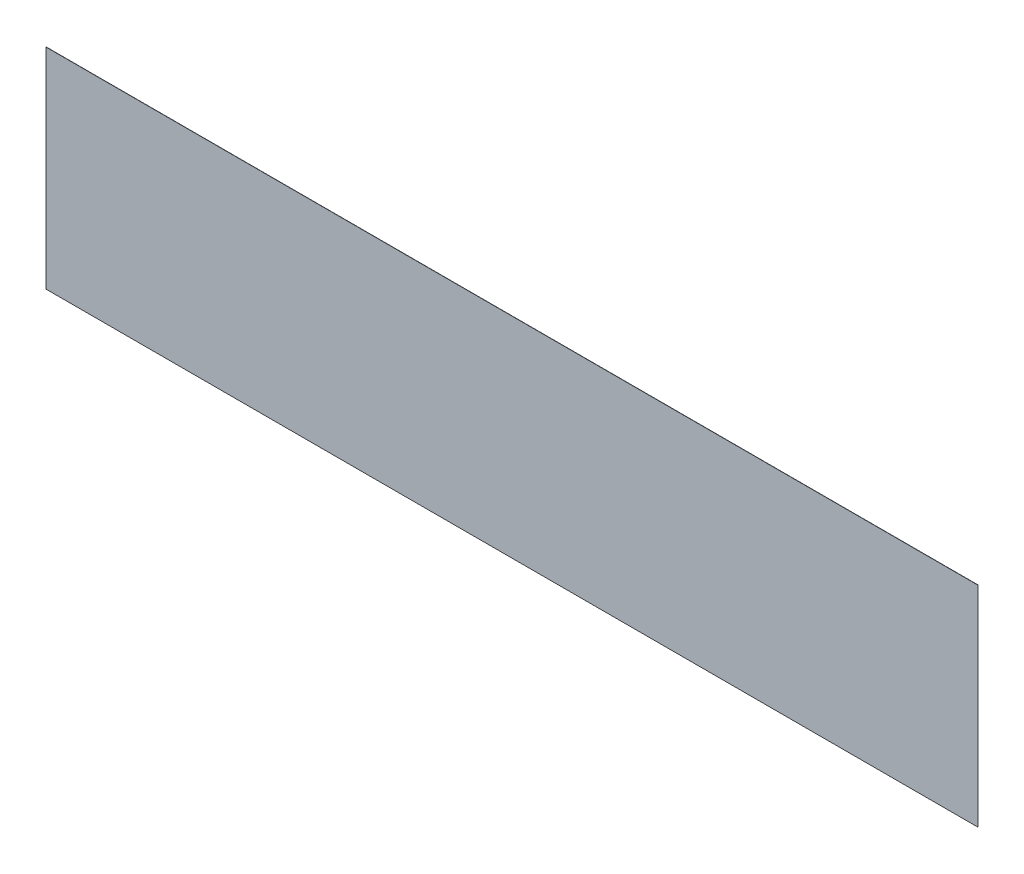
from build123d import *

# Parameters (mm, degrees)
SKETCH1_W           = 40
SKETCH1_H           = 9
BOSS_EXTRUDE1_DEPTH = 0.01


with BuildPart() as part:
    # Sketch1 → Boss-Extrude1 (new body)
    with BuildSketch(Plane.XY):
        Rectangle(SKETCH1_W, SKETCH1_H)
    extrude(amount=BOSS_EXTRUDE1_DEPTH)


solid = part.part
